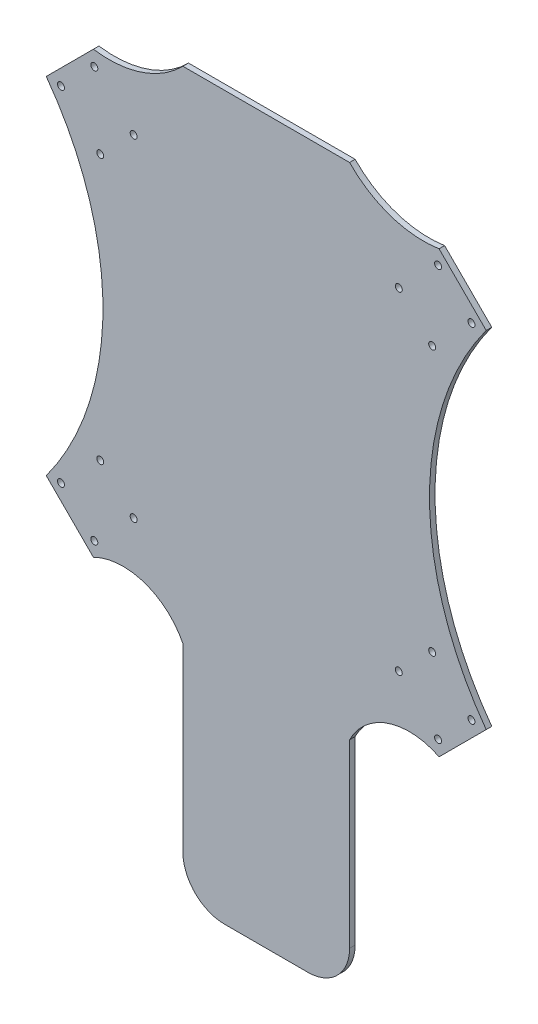
from build123d import *

# Parameters (mm, degrees)
BOSS_EXTRUDE1_DEPTH = 2
SKETCH3_R           = 1.25
CUT_EXTRUDE1_DEPTH  = 188.552659272


with BuildPart() as part:
    # Sketch2 → Boss-Extrude1 (new body)
    with BuildSketch(Plane.XY):
        with BuildLine():
            Line((-79.195959493, 62.225396744), (-62.225396744, 79.195959493))
            ThreePointArc((-62.225396744, 79.195959493), (-44.806778225, 80.702789346), (-30, 90))
            Line((-30, 90), (30, 90))
            ThreePointArc((30, 90), (44.806778225, 80.702789346), (62.225396744, 79.195959493))
            Line((62.225396744, 79.195959493), (79.195959493, 62.225396744))
            ThreePointArc((79.195959493, 62.225396744), (58.781303002, 0), (79.195959493, -62.225396744))
            Line((79.195959493, -62.225396744), (62.225396744, -79.195959493))
            ThreePointArc((62.225396744, -79.195959493), (43.875108319, -77.923881554), (30, -90))
            Line((30, -90), (30, -155))
            ThreePointArc((30, -155), (25.606601718, -165.606601718), (15, -170))
            Line((15, -170), (-15, -170))
            ThreePointArc((-15, -170), (-25.606601718, -165.606601718), (-30, -155))
            Line((-30, -155), (-30, -90))
            ThreePointArc((-30, -90), (-43.875108319, -77.923881554), (-62.225396744, -79.195959493))
            Line((-62.225396744, -79.195959493), (-79.195959493, -62.225396744))
            ThreePointArc((-79.195959493, -62.225396744), (-58.781303002, 0), (-79.195959493, 62.225396744))
        make_face()
    extrude(amount=BOSS_EXTRUDE1_DEPTH)

    # Sketch3 → Cut-Extrude1 (cut, through all)
    with BuildSketch(Plane.XY.offset(2)):
        with Locations((-73.892658634, 61.871843354)):
            Circle(SKETCH3_R)
        with Locations((-59.75052301, 47.72970773)):
            Circle(SKETCH3_R)
        with Locations(Location((-61.871843354, 73.892658634, 0), (0, 0, 180))):
            Circle(SKETCH3_R)
        with Locations(Location((-47.72970773, 59.75052301, 0), (0, 0, 180))):
            Circle(SKETCH3_R)
        with Locations(Location((59.75052301, 47.72970773, 0), (0, 0, 180))):
            Circle(SKETCH3_R)
        with Locations(Location((73.892658634, 61.871843354, 0), (0, 0, 180))):
            Circle(SKETCH3_R)
        with Locations((61.871843354, 73.892658634)):
            Circle(SKETCH3_R)
        with Locations((47.72970773, 59.75052301)):
            Circle(SKETCH3_R)
        with Locations(Location((-59.75052301, -47.72970773, 0), (0, 0, 180))):
            Circle(SKETCH3_R)
        with Locations((-47.72970773, -59.75052301)):
            Circle(SKETCH3_R)
        with Locations((-61.871843354, -73.892658634)):
            Circle(SKETCH3_R)
        with Locations(Location((-73.892658634, -61.871843354, 0), (0, 0, 180))):
            Circle(SKETCH3_R)
        with Locations((59.75052301, -47.72970773)):
            Circle(SKETCH3_R)
        with Locations((73.892658634, -61.871843354)):
            Circle(SKETCH3_R)
        with Locations(Location((61.871843354, -73.892658634, 0), (0, 0, 180))):
            Circle(SKETCH3_R)
        with Locations(Location((47.72970773, -59.75052301, 0), (0, 0, 180))):
            Circle(SKETCH3_R)
    extrude(amount=-CUT_EXTRUDE1_DEPTH, mode=Mode.SUBTRACT)


solid = part.part
